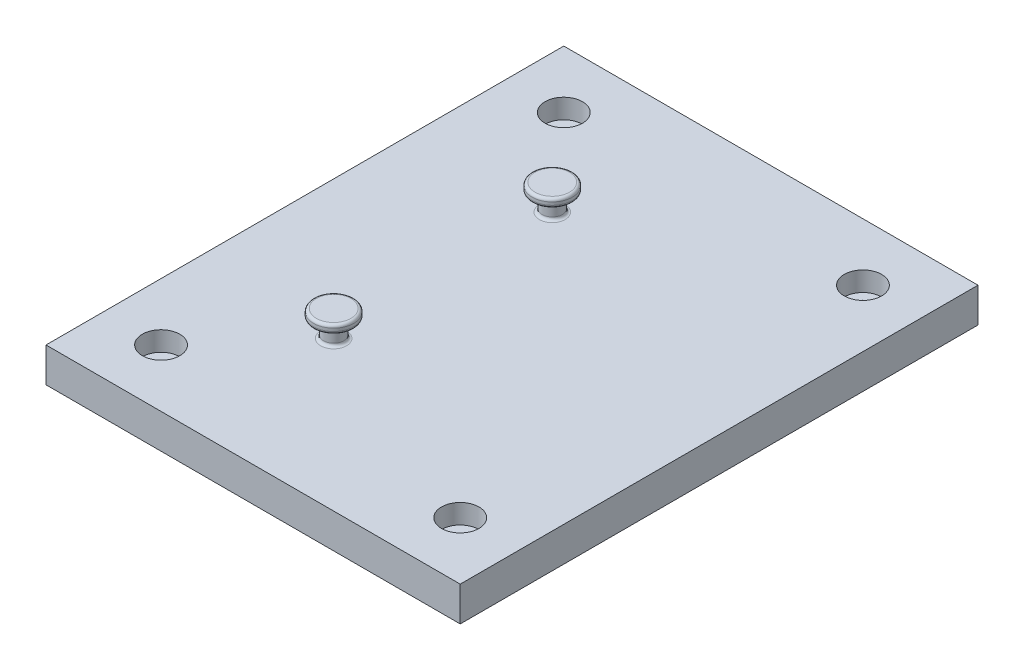
from build123d import *

# Parameters (mm, degrees)
SZKIC1_W                                            = 72
SZKIC1_H                                            = 90
DODANIE_WYCI_GNI_CIE1_DEPTH                         = 6
SZKIC2_R                                            = 1.75
DODANIE_WYCI_GNI_CIE2_DEPTH                         = 3
DODANIE_WYCI_GNI_CIE3_START                         = 3
SZKIC2_5_R                                          = 3.5
DODANIE_WYCI_GNI_CIE3_DEPTH                         = 1.5
ZAOKR_GLENIE1_R                                     = 0.5
CBORE_FOR_M3_HEX_SOCKET_HEAD_CAP_SCREW1_D           = 3.2
CBORE_FOR_M3_HEX_SOCKET_HEAD_CAP_SCREW1_DEPTH       = 7.7
CBORE_FOR_M3_HEX_SOCKET_HEAD_CAP_SCREW1_CBORE_D     = 6.5
CBORE_FOR_M3_HEX_SOCKET_HEAD_CAP_SCREW1_CBORE_DEPTH = 3.4
CBORE_FOR_M3_HEX_SOCKET_HEAD_CAP_SCREW1_TIP         = 0.96137699


with BuildPart() as part:
    # Szkic1 → Dodanie-wyciągnięcie1 (new body)
    with BuildSketch(Plane(origin=(0, 0, 0), x_dir=(1, 0, 0), z_dir=(0, 1, 0))):
        Rectangle(SZKIC1_W, SZKIC1_H)
    extrude(amount=DODANIE_WYCI_GNI_CIE1_DEPTH)

    # Szkic2 → Dodanie-wyciągnięcie2 (add)
    with BuildSketch(Plane(origin=(0, 6, 0), x_dir=(1, 0, 0), z_dir=(0, 1, 0))):
        with Locations(Location((-12, -19, 0), (0, 0, 270))):
            Circle(SZKIC2_R)
        with Locations(Location((-12, 19, 0), (0, 0, 270))):
            Circle(SZKIC2_R)
    extrude(amount=DODANIE_WYCI_GNI_CIE2_DEPTH)

    # Szkic2<5> → Dodanie-wyciągnięcie3 (add)
    with BuildSketch(Plane(origin=(0, 6, 0), x_dir=(1, 0, 0), z_dir=(0, 1, 0)).offset(DODANIE_WYCI_GNI_CIE3_START)):
        with Locations(Location((-12, 19, 0), (0, 0, 270))):
            Circle(SZKIC2_5_R)
        with Locations(Location((-12, -19, 0), (0, 0, 270))):
            Circle(SZKIC2_5_R)
    extrude(amount=DODANIE_WYCI_GNI_CIE3_DEPTH)

    # Zaokrąglenie1
    zaokr_glenie1_edges = [part.edges().sort_by_distance(p)[0] for p in [
        (-12, 6, 17.25),
        (-12, 6, -20.75),
        (-12, 9, 15.5),
        (-12, 10.5, 15.5),
        (-12, 9, -22.5),
        (-12, 10.5, -22.5),
    ]]
    fillet(zaokr_glenie1_edges, radius=ZAOKR_GLENIE1_R)

    # CBORE for M3 Hex Socket Head Cap Screw1
    with Locations(Plane(origin=(0, 6, 0), x_dir=(1, 0, 0), z_dir=(0, 1, 0))):
        with Locations((-26, 35), (26, 35), (26, -35), (-26, -35)):
            CounterBoreHole(CBORE_FOR_M3_HEX_SOCKET_HEAD_CAP_SCREW1_D / 2, CBORE_FOR_M3_HEX_SOCKET_HEAD_CAP_SCREW1_CBORE_D / 2, CBORE_FOR_M3_HEX_SOCKET_HEAD_CAP_SCREW1_CBORE_DEPTH, depth=CBORE_FOR_M3_HEX_SOCKET_HEAD_CAP_SCREW1_DEPTH)
            with Locations((0, 0, -(CBORE_FOR_M3_HEX_SOCKET_HEAD_CAP_SCREW1_DEPTH + CBORE_FOR_M3_HEX_SOCKET_HEAD_CAP_SCREW1_TIP / 2))):  # 118° drill point
                Cone(0, CBORE_FOR_M3_HEX_SOCKET_HEAD_CAP_SCREW1_D / 2, CBORE_FOR_M3_HEX_SOCKET_HEAD_CAP_SCREW1_TIP, mode=Mode.SUBTRACT)


solid = part.part
